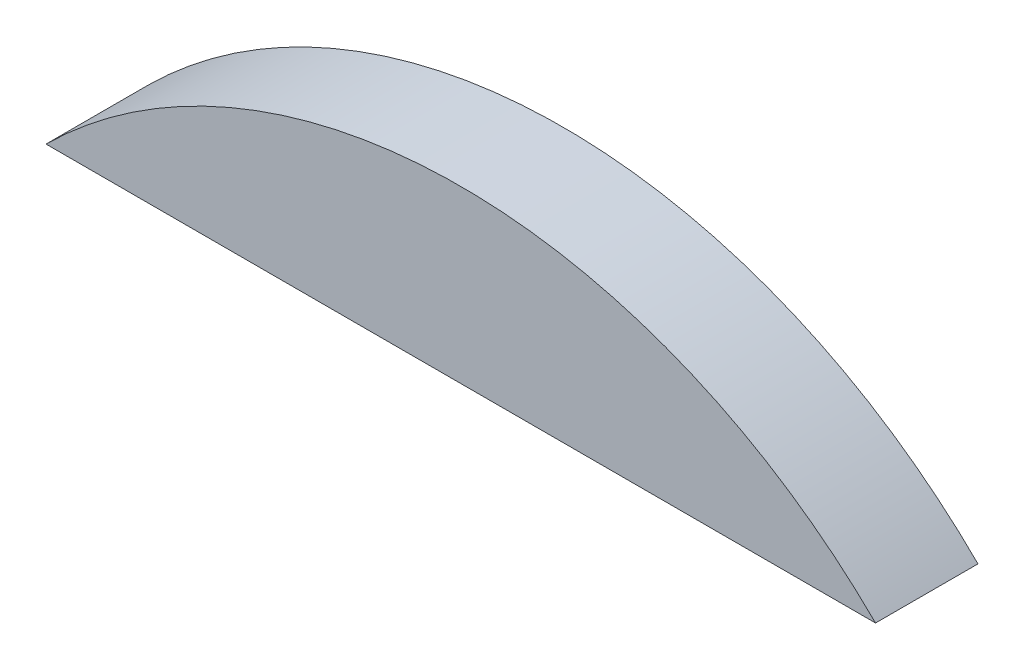
from build123d import *

# Parameters (mm, degrees)
BOSS_EXTRUDE1_DEPTH = 30


with BuildPart() as part:
    # Sketch1 → Boss-Extrude1 (new body)
    with BuildSketch(Plane.XY):
        with BuildLine():
            ThreePointArc((0, 172.5), (-65.669627683, 159.510971409), (-121.449578015, 122.5))
            Line((-121.449578015, 122.5), (0, 122.5))
            Line((0, 122.5), (0, 172.5))
        make_face()
        with BuildLine():
            Line((0, 172.5), (0, 122.5))
            Line((0, 122.5), (121.449578015, 122.5))
            ThreePointArc((121.449578015, 122.5), (65.669627683, 159.510971409), (0, 172.5))
        make_face()
    extrude(amount=-BOSS_EXTRUDE1_DEPTH)


solid = part.part
